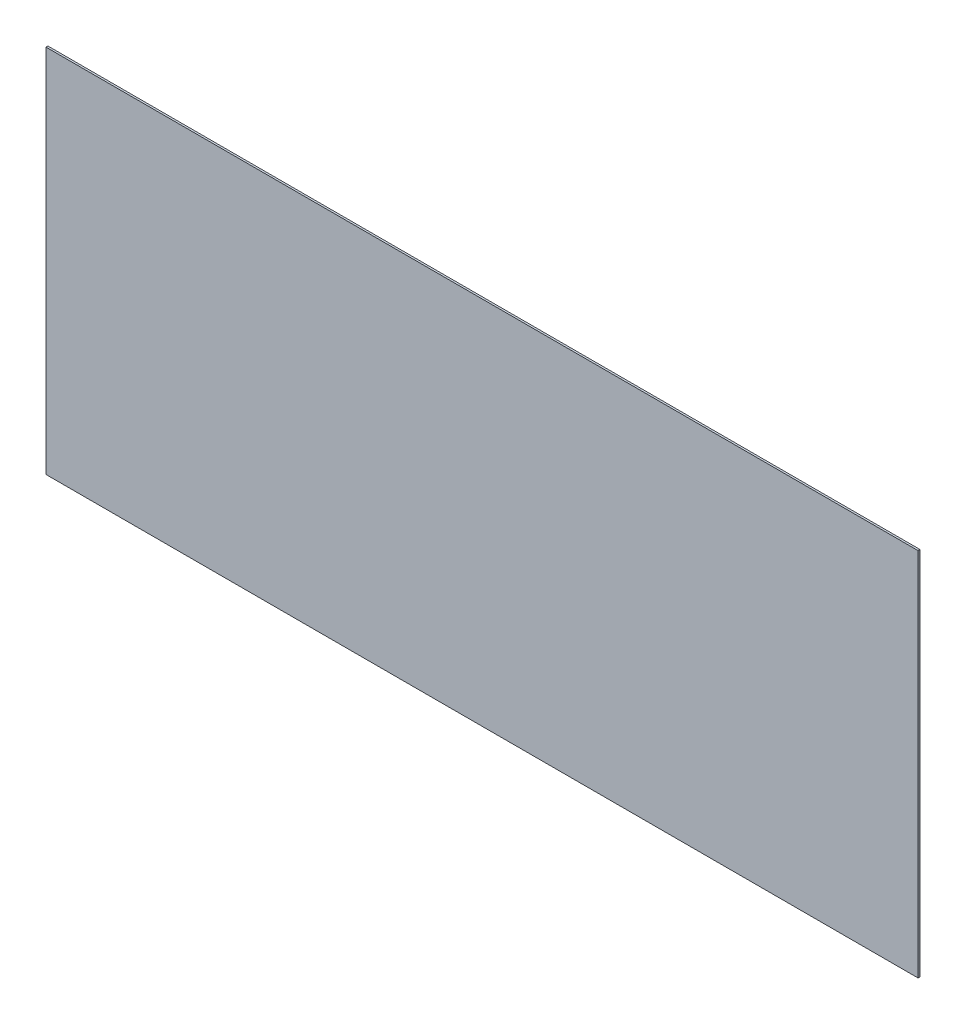
from build123d import *

# Parameters (mm, degrees)
SKETCH1_W           = 450
SKETCH1_H           = 191
BOSS_EXTRUDE1_DEPTH = 1


with BuildPart() as part:
    # Sketch1 → Boss-Extrude1 (new body)
    with BuildSketch(Plane.XY):
        Rectangle(SKETCH1_W, SKETCH1_H)
    extrude(amount=BOSS_EXTRUDE1_DEPTH)


solid = part.part
